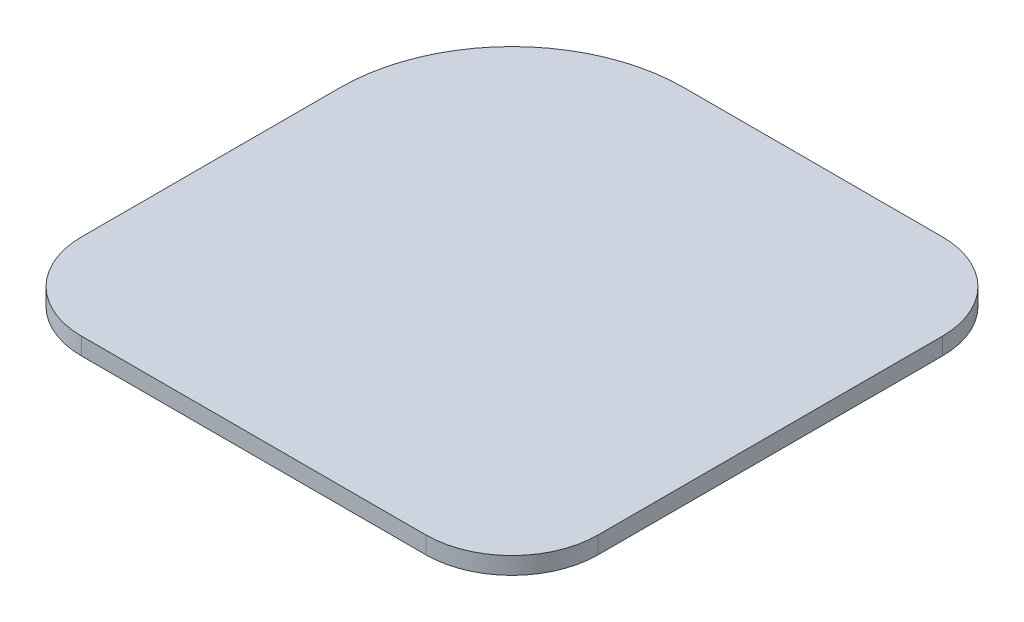
from build123d import *

# Parameters (mm, degrees)
BOSS_EXTRUDE1_DEPTH = 2


with BuildPart() as part:
    # Sketch2 → Boss-Extrude1 (new body)
    with BuildSketch(Plane(origin=(0, 0, 0), x_dir=(1, 0, 0), z_dir=(0, 1, 0))):
        with BuildLine():
            Line((-10, 30), (20, 30))
            ThreePointArc((20, 30), (27.071067812, 27.071067812), (30, 20))
            Line((30, 20), (30, -20))
            ThreePointArc((30, -20), (27.071067812, -27.071067812), (20, -30))
            Line((20, -30), (-20, -30))
            ThreePointArc((-20, -30), (-27.071067812, -27.071067812), (-30, -20))
            Line((-30, -20), (-30, 10))
            ThreePointArc((-30, 10), (-24.142135624, 24.142135624), (-10, 30))
        make_face()
    extrude(amount=BOSS_EXTRUDE1_DEPTH)


solid = part.part
